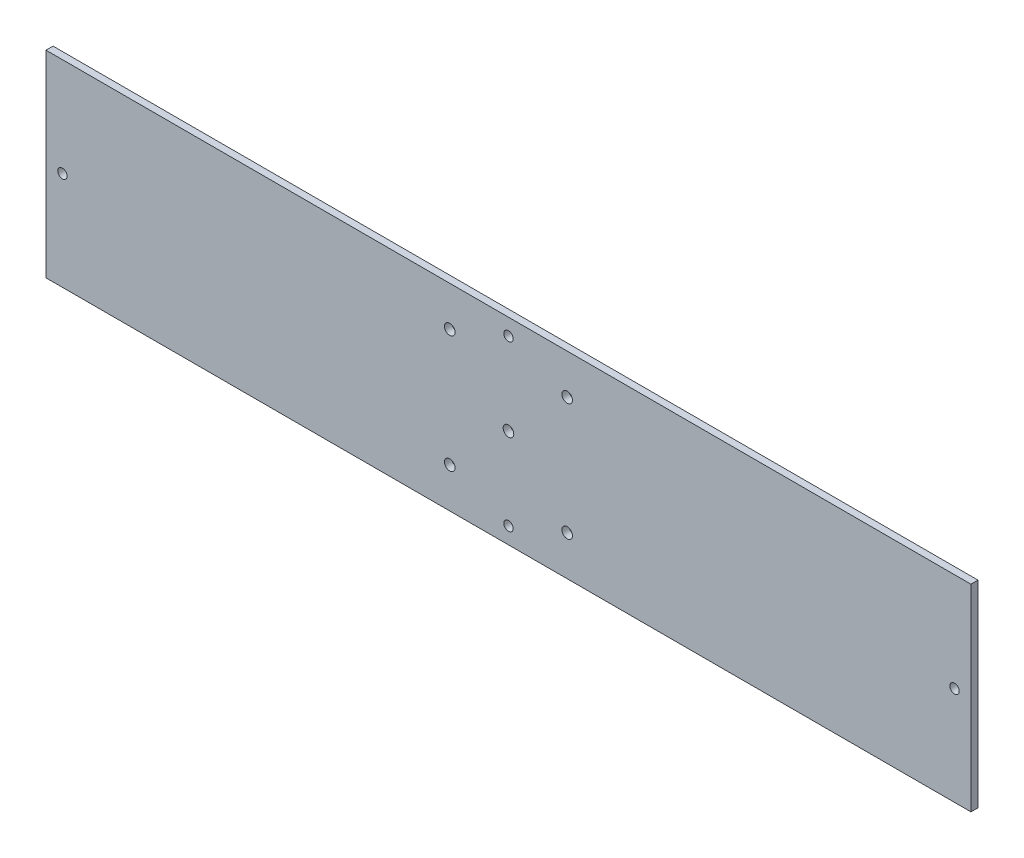
from build123d import *

# Parameters (mm, degrees)
SCHIZZO1_W                   = 394
SCHIZZO1_H                   = 84
SCHIZZO1_R                   = 2
SCHIZZO1_R_2                 = 2.25
ESTRUSIONE_ESTRUSIONE1_DEPTH = 3


with BuildPart() as part:
    # Schizzo1 → Estrusione-Estrusione1 (new body)
    with BuildSketch(Plane.XY):
        with Locations((197, 42)):
            Rectangle(SCHIZZO1_W, SCHIZZO1_H)
        with Locations((7, 42)):
            Circle(SCHIZZO1_R, mode=Mode.SUBTRACT)
        with Locations((197, 77)):
            Circle(SCHIZZO1_R, mode=Mode.SUBTRACT)
        with Locations((197, 7)):
            Circle(SCHIZZO1_R, mode=Mode.SUBTRACT)
        with Locations((387, 42)):
            Circle(SCHIZZO1_R, mode=Mode.SUBTRACT)
        with Locations((197, 42)):
            Circle(SCHIZZO1_R_2, mode=Mode.SUBTRACT)
        with Locations((172, 67)):
            Circle(SCHIZZO1_R_2, mode=Mode.SUBTRACT)
        with Locations((172, 17)):
            Circle(SCHIZZO1_R_2, mode=Mode.SUBTRACT)
        with Locations((222, 17)):
            Circle(SCHIZZO1_R_2, mode=Mode.SUBTRACT)
        with Locations((222, 67)):
            Circle(SCHIZZO1_R_2, mode=Mode.SUBTRACT)
    extrude(amount=ESTRUSIONE_ESTRUSIONE1_DEPTH)


solid = part.part
